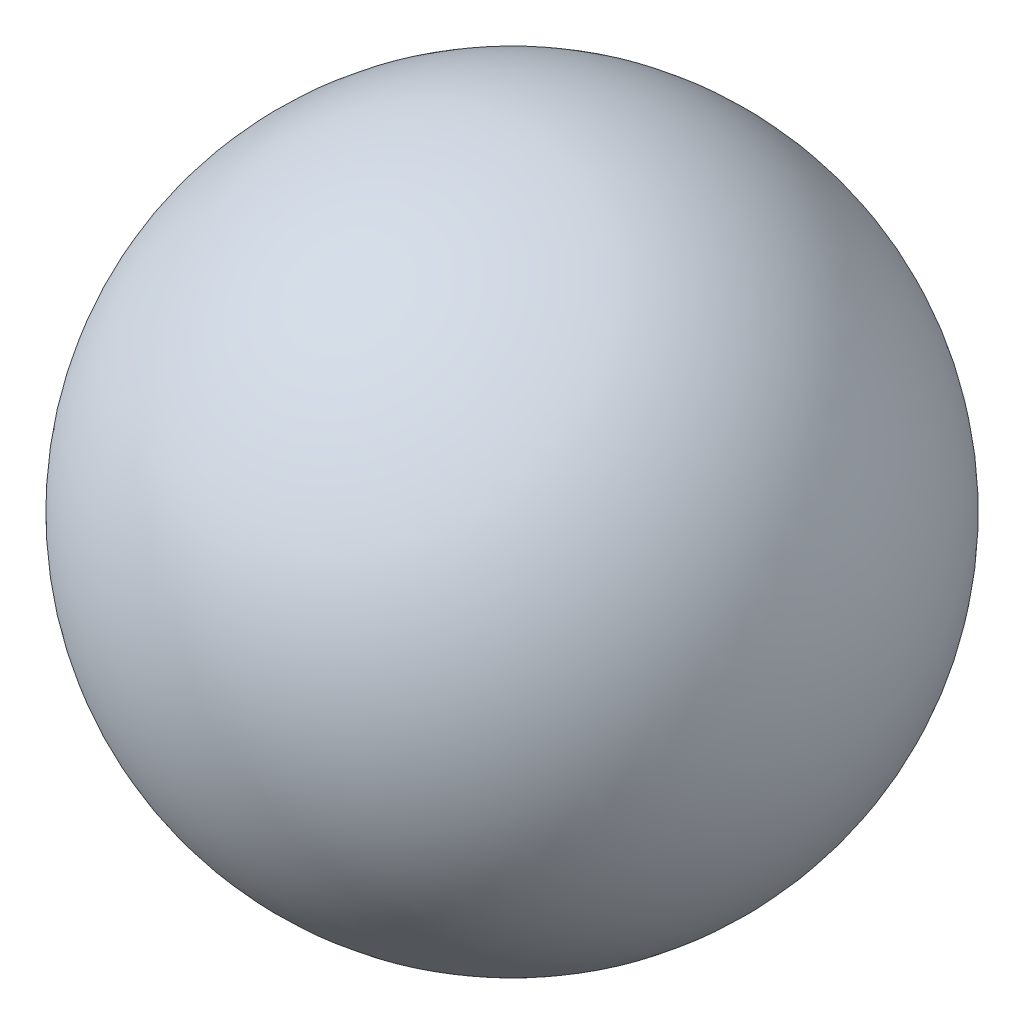
from build123d import *


with BuildPart() as part:
    # Sketch1 → Revolve1 (revolve)
    with BuildSketch(Plane.XY):
        with BuildLine():
            Line((0, 20), (0, 19))
            ThreePointArc((0, 19), (-19, 0), (0, -19))
            Line((0, -19), (0, -20))
            ThreePointArc((0, -20), (-20, 0), (0, 20))
        make_face()
    revolve(axis=Axis((0, 20, 0), (0, -1, 0)))


solid = part.part
